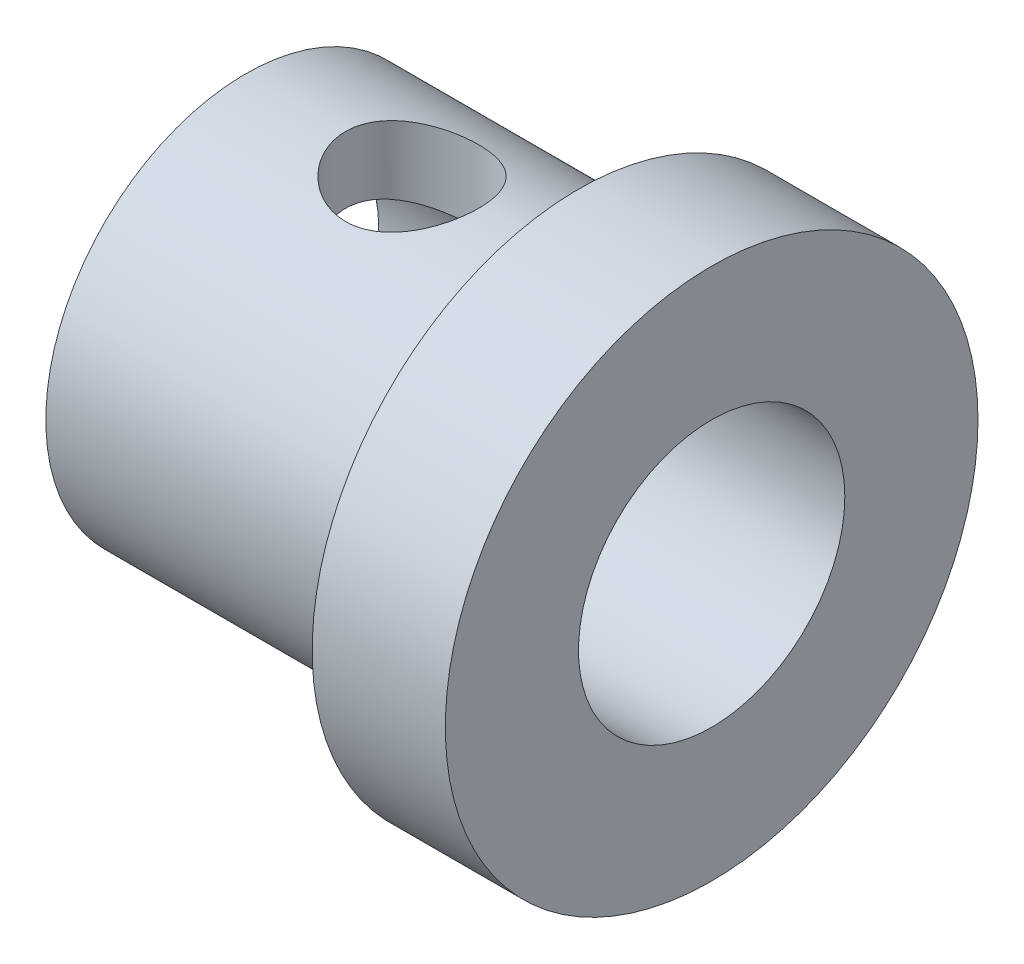
from build123d import *

# Parameters (mm, degrees)
SKETCH1_R               = 3
BOSS_EXTRUDE1_DEPTH     = 3.5
SKETCH2_R               = 4
BOSS_EXTRUDE2_DEPTH     = 2
SKETCH3_R               = 2
CUT_EXTRUDE1_DEPTH      = 10
CUT_EXTRUDE2_DEPTH      = 7.652067348
CUT_EXTRUDE2_DEPTH_BACK = 7.652067348
SKETCH4_R               = 1


with BuildPart() as part:
    # Sketch1 → Boss-Extrude1 (new, symmetric)
    with BuildSketch(Plane(origin=(0, 0, 0), x_dir=(0, 0, -1), z_dir=(1, 0, 0))):
        Circle(SKETCH1_R)
    extrude(amount=BOSS_EXTRUDE1_DEPTH, both=True)

    # Sketch2 → Boss-Extrude2 (add)
    with BuildSketch(Plane(origin=(3.5, 0, 0), x_dir=(0, 0, -1), z_dir=(1, 0, 0))):
        Circle(SKETCH2_R)
    extrude(amount=-BOSS_EXTRUDE2_DEPTH)

    # Sketch3 → Cut-Extrude1 (cut, through all)
    with BuildSketch(Plane(origin=(3.5, 0, 0), x_dir=(0, 0, -1), z_dir=(1, 0, 0))):
        Circle(SKETCH3_R)
    extrude(amount=-CUT_EXTRUDE1_DEPTH, mode=Mode.SUBTRACT)

    # Sketch4 → Cut-Extrude2 (cut, two sides: drawn at the far end of the back side and taken through both)
    with BuildSketch(Plane(origin=(0, 0, 0), x_dir=(1, 0, 0), z_dir=(0, 1, 0)).offset(-CUT_EXTRUDE2_DEPTH_BACK)):
        with Locations(Location((-1, 0, 0), (0, 0, 270))):
            Circle(SKETCH4_R)
    extrude(amount=CUT_EXTRUDE2_DEPTH + CUT_EXTRUDE2_DEPTH_BACK, mode=Mode.SUBTRACT)


solid = part.part
